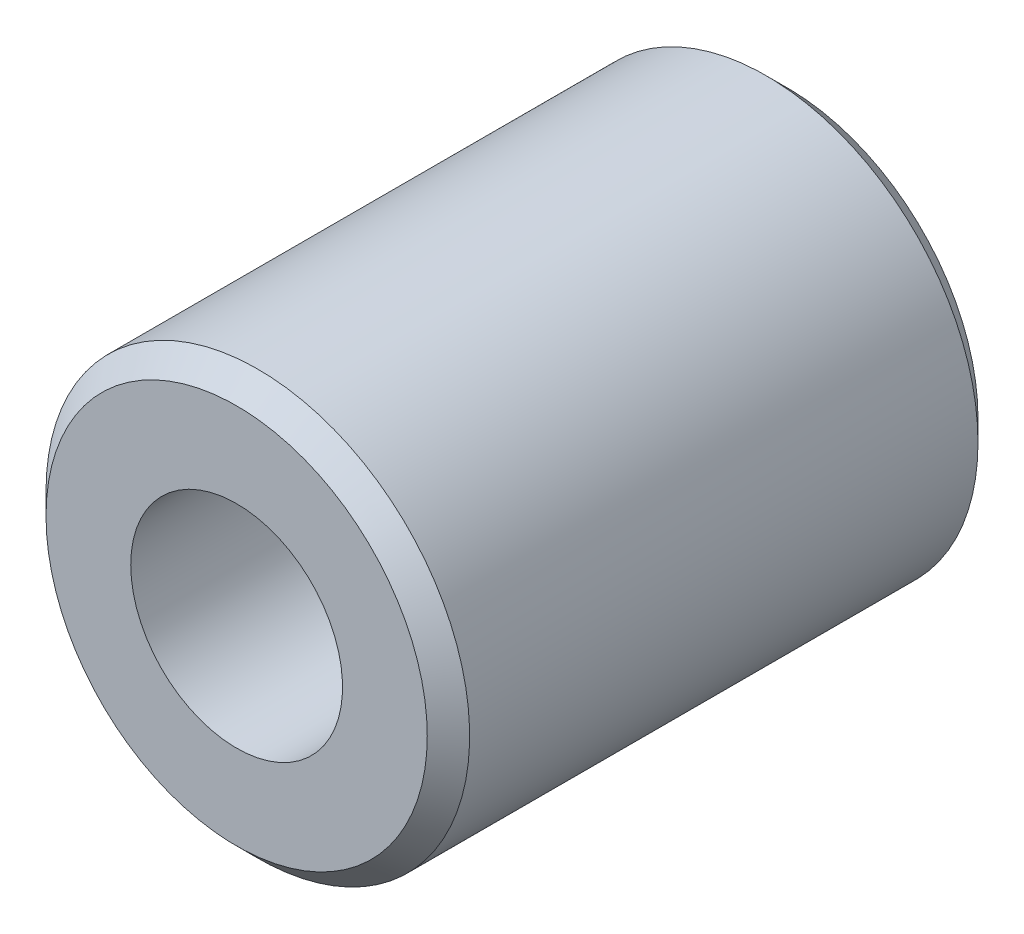
from build123d import *

# Parameters (mm, degrees)
SKETCH1_R           = 5
SKETCH1_R_2         = 2.5
BOSS_EXTRUDE1_DEPTH = 13
CHAMFER1_SIZE       = 0.5


with BuildPart() as part:
    # Sketch1 → Boss-Extrude1 (new body)
    with BuildSketch(Plane.XY):
        with Locations(Location((0, 0, 0), (0, 0, 180))):
            Circle(SKETCH1_R)
        with Locations(Location((0, 0, 0), (0, 0, 180))):
            Circle(SKETCH1_R_2, mode=Mode.SUBTRACT)
    extrude(amount=BOSS_EXTRUDE1_DEPTH)

    # Chamfer1
    chamfer1_edges = [part.edges().sort_by_distance(p)[0] for p in [
        (5, 0, 0),
        (5, 0, 13),
    ]]
    chamfer(chamfer1_edges, length=CHAMFER1_SIZE)


solid = part.part
